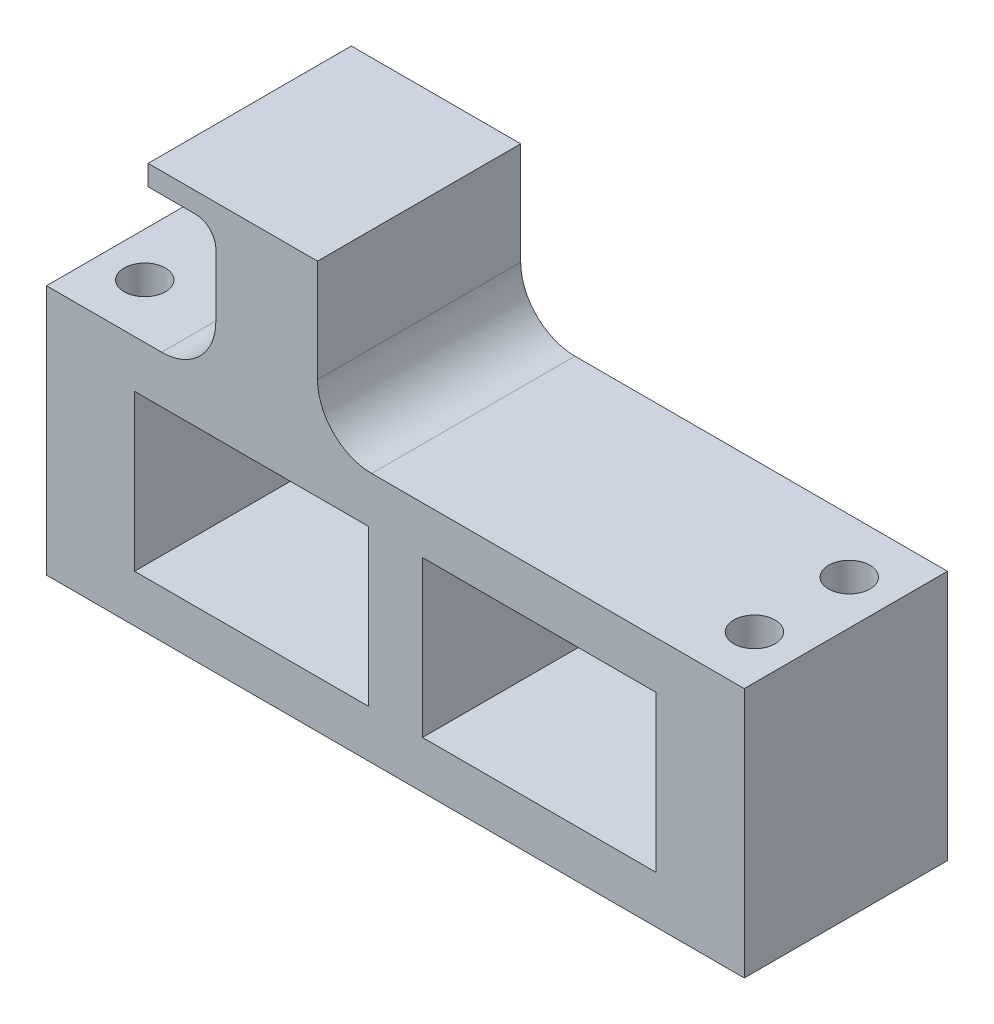
from build123d import *

# Parameters (mm, degrees)
SKETCH1_W           = 103
SKETCH1_H           = 30
BOSS_EXTRUDE1_DEPTH = 7
SKETCH2_W           = 13
SKETCH2_H           = 30
SKETCH2_W_2         = 4
BOSS_EXTRUDE2_DEPTH = 23
SKETCH3_W           = 103
SKETCH3_H           = 30
BOSS_EXTRUDE3_DEPTH = 7
SKETCH4_W           = 15
SKETCH4_H           = 30
BOSS_EXTRUDE4_DEPTH = 20.15
SKETCH5_W           = 25
SKETCH5_H           = 30
BOSS_EXTRUDE5_DEPTH = 3
FILLET2_R           = 3
FILLET3_R           = 8
SKETCH6_R           = 3.05
CUT_EXTRUDE1_DEPTH  = 40


with BuildPart() as part:
    # Sketch1 → Boss-Extrude1 (new body)
    with BuildSketch(Plane(origin=(0, 0, 0), x_dir=(1, 0, 0), z_dir=(0, 1, 0))):
        with Locations((51.5, 15)):
            Rectangle(SKETCH1_W, SKETCH1_H)
    extrude(amount=BOSS_EXTRUDE1_DEPTH)

    # Sketch2 → Boss-Extrude2 (add)
    with BuildSketch(Plane(origin=(0, 7, 0), x_dir=(1, 0, 0), z_dir=(0, 1, 0))):
        with Locations((6.5, 15)):
            Rectangle(SKETCH2_W, SKETCH2_H)
        with Locations((49.5, 15)):
            Rectangle(SKETCH2_W_2, SKETCH2_H)
        with Locations((53.5, 15)):
            Rectangle(SKETCH2_W_2, SKETCH2_H)
        with Locations((96.5, 15)):
            Rectangle(SKETCH2_W, SKETCH2_H)
    extrude(amount=BOSS_EXTRUDE2_DEPTH)

    # Sketch3 → Boss-Extrude3 (add)
    with BuildSketch(Plane(origin=(0, 30, 0), x_dir=(1, 0, 0), z_dir=(0, 1, 0))):
        with Locations((51.5, 15)):
            Rectangle(SKETCH3_W, SKETCH3_H)
    extrude(amount=BOSS_EXTRUDE3_DEPTH)

    # Sketch4 → Boss-Extrude4 (add)
    with BuildSketch(Plane(origin=(0, 37, 0), x_dir=(1, 0, 0), z_dir=(0, 1, 0))):
        with Locations((32.5, 15)):
            Rectangle(SKETCH4_W, SKETCH4_H)
    extrude(amount=BOSS_EXTRUDE4_DEPTH)

    # Sketch5 → Boss-Extrude5 (add)
    with BuildSketch(Plane(origin=(0, 57.15, 0), x_dir=(1, 0, 0), z_dir=(0, 1, 0))):
        with Locations((27.5, 15)):
            Rectangle(SKETCH5_W, SKETCH5_H)
    extrude(amount=BOSS_EXTRUDE5_DEPTH)

    # Fillet2
    fillet2_edges = [part.edges().sort_by_distance(p)[0] for p in [
        (25, 57.15, -15),
    ]]
    fillet(fillet2_edges, radius=FILLET2_R)

    # Fillet3
    fillet3_edges = [part.edges().sort_by_distance(p)[0] for p in [
        (25, 37, -15),
        (40, 37, -15),
    ]]
    fillet(fillet3_edges, radius=FILLET3_R)

    # Sketch6 → Cut-Extrude1 (cut)
    with BuildSketch(Plane.XZ):
        with Locations(Location((6.5, -22, 0), (0, 0, 270))):
            Circle(SKETCH6_R)
        with Locations(Location((6.5, -8, 0), (0, 0, 270))):
            Circle(SKETCH6_R)
        with Locations(Location((96.5, -8, 0), (0, 0, 270))):
            Circle(SKETCH6_R)
        with Locations(Location((96.5, -22, 0), (0, 0, 270))):
            Circle(SKETCH6_R)
    extrude(amount=-CUT_EXTRUDE1_DEPTH, mode=Mode.SUBTRACT)


solid = part.part
